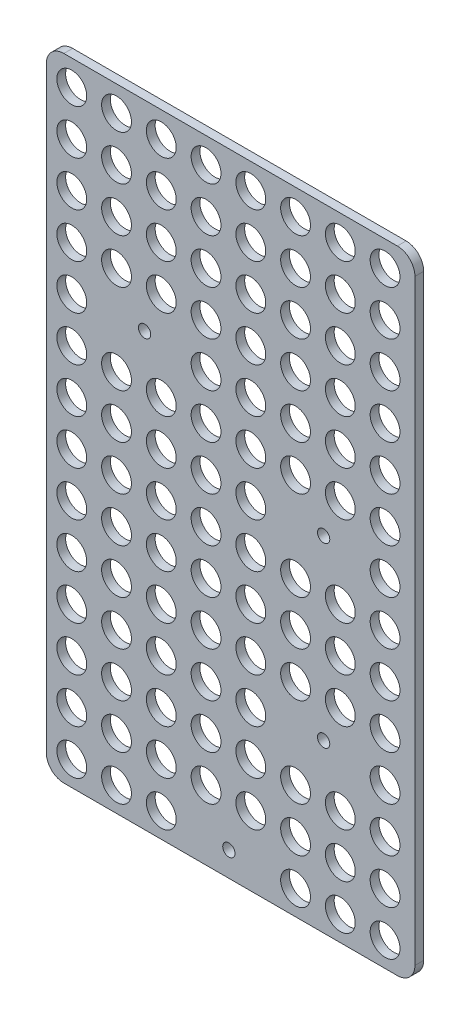
from build123d import *

# Parameters (mm, degrees)
SKETCH1_W            = 105
SKETCH1_H            = 180
SKETCH1_R            = 1.75
BOSS_EXTRUDE1_DEPTH  = 2.5
FILLET2_R            = 5
CUT_EXTRUDE1_REACH   = 210.402
SKETCH2_R            = 4.25
LPATTERN1_COUNT      = 8
LPATTERN1_PITCH      = 12.75
LPATTERN1_COUNT_DIR2 = 14
LPATTERN1_PITCH_DIR2 = 12.75


with BuildPart() as part:
    # Sketch1 → Boss-Extrude1 (new body)
    with BuildSketch(Plane.XY):
        with Locations((52.5, 90)):
            Rectangle(SKETCH1_W, SKETCH1_H)
        with Locations((28, 123)):
            Circle(SKETCH1_R, mode=Mode.SUBTRACT)
        with Locations((79, 98)):
            Circle(SKETCH1_R, mode=Mode.SUBTRACT)
        with Locations((79, 47.5)):
            Circle(SKETCH1_R, mode=Mode.SUBTRACT)
        with Locations((52, 7)):
            Circle(SKETCH1_R, mode=Mode.SUBTRACT)
    extrude(amount=BOSS_EXTRUDE1_DEPTH)

    # Fillet2
    fillet2_edges = [part.edges().sort_by_distance(p)[0] for p in [
        (0, 180, 1.25),
        (105, 180, 1.25),
        (105, 0, 1.25),
        (0, 0, 1.25),
    ]]
    fillet(fillet2_edges, radius=FILLET2_R)

    # Sketch2 → Cut-Extrude1 (cut, up to next)
    with BuildSketch(Plane.XY.offset(2.5), mode=Mode.PRIVATE) as cut_extrude1_sk1:
        with Locations((7.25, 172.75)):
            Circle(SKETCH2_R)
    cut_extrude1_tool1 = extrude(cut_extrude1_sk1.sketch, amount=-CUT_EXTRUDE1_REACH, mode=Mode.PRIVATE) & part.part
    cut_extrude1 = cut_extrude1_tool1.solids().sort_by_distance((7.25, 172.75, 2.5))[0]
    add(cut_extrude1, mode=Mode.SUBTRACT)

    # LPattern1: Cut-Extrude1 8 × 14, 8 skipped
    with Locations(*[(i * LPATTERN1_PITCH, -j * LPATTERN1_PITCH_DIR2, 0) for i in range(LPATTERN1_COUNT) for j in range(LPATTERN1_COUNT_DIR2) if (i, j) not in ((0, 0), (1, 4), (2, 4), (3, 13), (4, 13), (5, 6), (5, 10), (6, 6), (6, 10))]):
        add(cut_extrude1, mode=Mode.SUBTRACT)


solid = part.part
